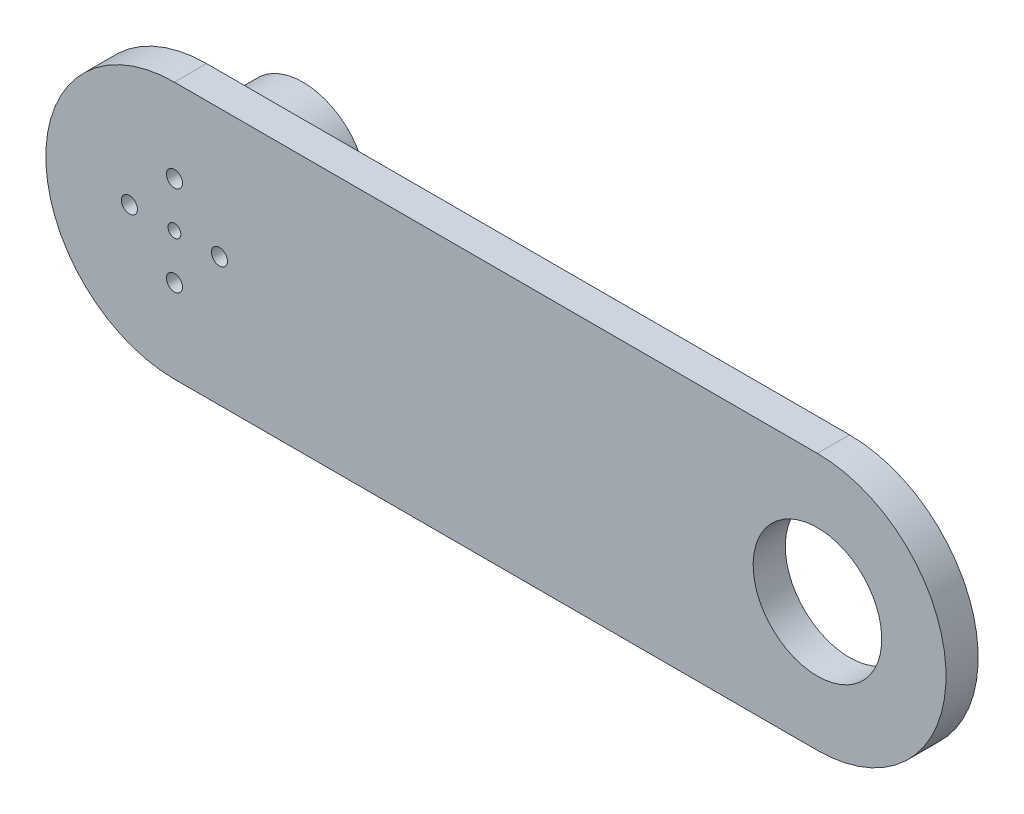
from build123d import *

# Parameters (mm, degrees)
BOSS_EXTRUDE1_DEPTH   = 5
CUT_EXTRUDE1_REACH    = 123.758
SKETCH2_R             = 1
SKETCH2_R_2           = 1.25
CUT_EXTRUDE2_REACH    = 123.758
SKETCH3_R             = 10
SKETCH4_R             = 10
BOSS_EXTRUDE2_DEPTH   = 15
BODY_MOVE_COPY1_ANGLE = 90


with BuildPart() as part:
    # Sketch1 → Boss-Extrude1 (new body)
    with BuildSketch(Plane(origin=(0, 0, 0), x_dir=(1, 0, 0), z_dir=(0, 1, 0))):
        with BuildLine():
            Line((100, -20), (0, -20))
            ThreePointArc((0, -20), (-20, 0), (0, 20))
            Line((0, 20), (100, 20))
            ThreePointArc((100, 20), (120, 0), (100, -20))
        make_face()
    extrude(amount=BOSS_EXTRUDE1_DEPTH)

    # Sketch2 → Cut-Extrude1 (cut, up to next)
    with BuildSketch(Plane(origin=(0, 5, 0), x_dir=(1, 0, 0), z_dir=(0, 1, 0)), mode=Mode.PRIVATE) as cut_extrude1_sk1:
        with Locations(Location((0, 0, 0), (0, 0, 270))):
            Circle(SKETCH2_R)
    cut_extrude1_tool1 = extrude(cut_extrude1_sk1.sketch, amount=-CUT_EXTRUDE1_REACH, mode=Mode.PRIVATE) & part.part
    # Sketch2 → Cut-Extrude1 (cut, up to next)
    with BuildSketch(Plane(origin=(0, 5, 0), x_dir=(1, 0, 0), z_dir=(0, 1, 0)), mode=Mode.PRIVATE) as cut_extrude1_sk2:
        with Locations(Location((0, 7, 0), (0, 0, 270))):
            Circle(SKETCH2_R_2)
    cut_extrude1_tool2 = extrude(cut_extrude1_sk2.sketch, amount=-CUT_EXTRUDE1_REACH, mode=Mode.PRIVATE) & part.part
    # Sketch2 → Cut-Extrude1 (cut, up to next)
    with BuildSketch(Plane(origin=(0, 5, 0), x_dir=(1, 0, 0), z_dir=(0, 1, 0)), mode=Mode.PRIVATE) as cut_extrude1_sk3:
        with Locations(Location((7.001, 0.001, 0), (0, 0, 270))):
            Circle(SKETCH2_R_2)
    cut_extrude1_tool3 = extrude(cut_extrude1_sk3.sketch, amount=-CUT_EXTRUDE1_REACH, mode=Mode.PRIVATE) & part.part
    # Sketch2 → Cut-Extrude1 (cut, up to next)
    with BuildSketch(Plane(origin=(0, 5, 0), x_dir=(1, 0, 0), z_dir=(0, 1, 0)), mode=Mode.PRIVATE) as cut_extrude1_sk4:
        with Locations(Location((0.002, -7, 0), (0, 0, 270))):
            Circle(SKETCH2_R_2)
    cut_extrude1_tool4 = extrude(cut_extrude1_sk4.sketch, amount=-CUT_EXTRUDE1_REACH, mode=Mode.PRIVATE) & part.part
    # Sketch2 → Cut-Extrude1 (cut, up to next)
    with BuildSketch(Plane(origin=(0, 5, 0), x_dir=(1, 0, 0), z_dir=(0, 1, 0)), mode=Mode.PRIVATE) as cut_extrude1_sk5:
        with Locations(Location((-6.999, -0.001, 0), (0, 0, 270))):
            Circle(SKETCH2_R_2)
    cut_extrude1_tool5 = extrude(cut_extrude1_sk5.sketch, amount=-CUT_EXTRUDE1_REACH, mode=Mode.PRIVATE) & part.part
    add(cut_extrude1_tool1.solids().sort_by_distance((0, 5, 0))[0], mode=Mode.SUBTRACT)
    add(cut_extrude1_tool2.solids().sort_by_distance((0, 5, -7))[0], mode=Mode.SUBTRACT)
    add(cut_extrude1_tool3.solids().sort_by_distance((7.001, 5, -0.001))[0], mode=Mode.SUBTRACT)
    add(cut_extrude1_tool4.solids().sort_by_distance((0.002, 5, 7))[0], mode=Mode.SUBTRACT)
    add(cut_extrude1_tool5.solids().sort_by_distance((-6.999, 5, 0.001))[0], mode=Mode.SUBTRACT)

    # Sketch3 → Cut-Extrude2 (cut, up to next)
    with BuildSketch(Plane(origin=(0, 5, 0), x_dir=(1, 0, 0), z_dir=(0, 1, 0)), mode=Mode.PRIVATE) as cut_extrude2_sk1:
        with Locations(Location((100, 0, 0), (0, 0, 270))):
            Circle(SKETCH3_R)
    cut_extrude2_tool1 = extrude(cut_extrude2_sk1.sketch, amount=-CUT_EXTRUDE2_REACH, mode=Mode.PRIVATE) & part.part
    add(cut_extrude2_tool1.solids().sort_by_distance((100, 5, 0))[0], mode=Mode.SUBTRACT)

    # Sketch4 → Boss-Extrude2 (add)
    with BuildSketch(Plane.XZ):
        with Locations(Location((0, 0, 0), (0, 0, 90))):
            Circle(SKETCH4_R)
    extrude(amount=BOSS_EXTRUDE2_DEPTH)


with BuildPart() as part_1:
    # Body-Move/Copy1: moved
    add(part.part.rotate(Axis((0, 0, 0), (1, 0, 0)), BODY_MOVE_COPY1_ANGLE))


with BuildPart() as part_2:
    # Body-Move/Copy2: moved
    add(part_1.part.moved(Location((0, 0, -5))))


solid = part_2.part
